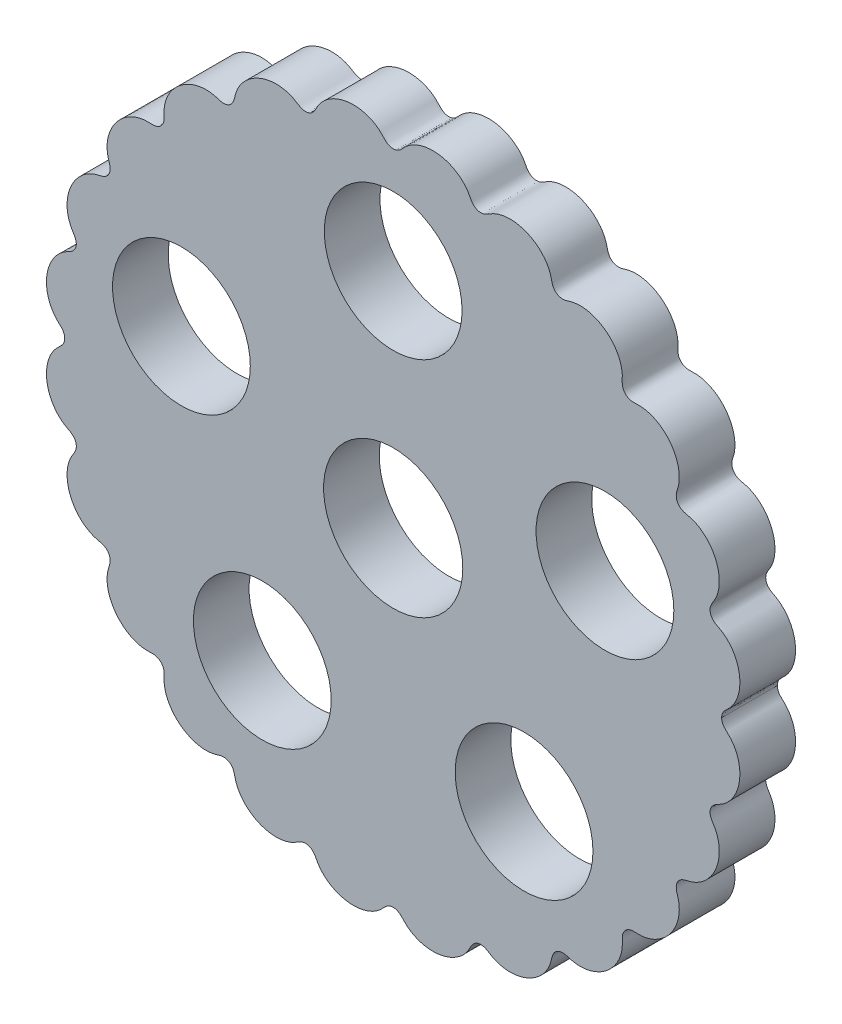
from build123d import *

# Parameters (mm, degrees)
BOSS_EXTRU_1_DEPTH      = 4
ESQUISSE2_R             = 5
ESQUISSE2_R_2           = 4.95
ENL_V_MAT_EXTRU_1_DEPTH = 36.458414662


with BuildPart() as part:
    # Esquisse1 → Boss.-Extru.1 (new body)
    with BuildSketch(Plane.XY):
        with BuildLine():
            add(Edge.make_bspline(
                [(23.6, 0), (23.6, 0.141263317), (23.694957489, 0.436529968), (23.984105148, 0.699966416), (24.214098656, 0.92210788), (24.485922993, 1.265914284), (24.738195558, 1.753151116), (24.902804155, 2.39533748), (24.929061691, 3.058471588), (24.820146126, 3.713569854), (24.57955061, 4.33187121), (24.214467979, 4.883674944), (23.809838813, 5.256722709), (23.444567676, 5.486205657), (23.121830867, 5.632182108), (22.805829464, 5.950444407), (22.734313606, 6.404992853), (22.914932417, 6.792042139), (23.100388311, 7.061569454), (23.241322807, 7.357836955), (23.379653116, 7.771179165), (23.455167998, 8.317175234), (23.400481311, 8.977844215), (23.210210839, 9.613984821), (22.894930523, 10.198352072), (22.466428325, 10.704182585), (22.026991864, 11.036841208), (21.636830993, 11.231351768), (21.327761788, 11.341047304), (21.006646284, 11.400550336), (20.604652425, 11.546398108), (20.33360552, 11.919233538), (20.332098964, 12.366005113), (20.45722004, 12.699209104), (20.553070598, 13.118610088), (20.575521706, 13.669103022), (20.443453625, 14.317226653), (20.176384255, 14.92460977), (19.790172286, 15.464839232), (19.30269971, 15.915187436), (18.732196788, 16.252890186), (18.209304306, 16.419015566), (17.773926091, 16.469947133), (17.454880581, 16.46414596), (17.062370957, 16.447336106), (16.654155245, 16.654181217), (16.447354302, 17.062303221), (16.463995345, 17.454871193), (16.47000351, 17.773792082), (16.418987054, 18.209391085), (16.252899593, 18.732164041), (15.915186599, 19.302700185), (15.464853958, 19.790162793), (14.924615452, 20.176378936), (14.317280714, 20.443456307), (13.668954873, 20.575502528), (13.119018963, 20.55312993), (12.698551766, 20.457182646), (12.366975365, 20.332173557), (11.918544843, 20.333761346), (11.546613574, 20.604610058), (11.40064872, 21.005766845), (11.341293082, 21.327714877), (11.231226117, 21.63694), (11.036938401, 22.026913374), (10.704156075, 22.466459205), (10.198341832, 22.894933668), (9.613976893, 23.210215116), (8.977833581, 23.400481614), (8.317182897, 23.455167864), (7.771097903, 23.379662569), (7.357907338, 23.241306143), (7.061498599, 23.100444819), (6.791854452, 22.914860356), (6.404942564, 22.734347878), (5.950451983, 22.805835984), (5.632237823, 23.121749776), (5.486345168, 23.444347145), (5.256676854, 23.809987802), (4.883690774, 24.214428605), (4.331849996, 24.5795686), (3.713564416, 24.820144223), (3.058466294, 24.929064174), (2.395320656, 24.902799203), (1.753142261, 24.73820842), (1.265895934, 24.485857583), (0.922135884, 24.214172246), (0.700203774, 23.984231078), (0.434473803, 23.694819976), (5.2772e-05, 23.552557421), (-0.434333113, 23.694820917), (-0.701425566, 23.984569), (-0.921337471, 24.213735069), (-1.266478689, 24.486196796), (-1.752999049, 24.738117012), (-2.395391205, 24.902832375), (-3.058454415, 24.929057732), (-3.713563151, 24.82014516), (-4.331853239, 24.579567427), (-4.883691331, 24.214428226), (-5.256677903, 23.809987443), (-5.4863451, 23.44434672), (-5.632237756, 23.12174991), (-5.950451972, 22.805835957), (-6.404942594, 22.734347884), (-6.791854452, 22.914860344), (-7.061498587, 23.100444822), (-7.357907347, 23.241306142), (-7.771097896, 23.37966257), (-8.317182899, 23.455167864), (-8.977833581, 23.400481614), (-9.613976894, 23.210215116), (-10.198341833, 22.894933668), (-10.704156075, 22.466459205), (-11.036938403, 22.026913373), (-11.231226116, 21.636940001), (-11.341293084, 21.327714875), (-11.400648718, 21.005766845), (-11.546613572, 20.60461006), (-11.918544844, 20.333761347), (-12.366975388, 20.332173538), (-12.698551664, 20.457182667), (-13.119019113, 20.553129909), (-13.668955007, 20.575502444), (-14.31728076, 20.443456275), (-14.924615464, 20.176378324), (-15.46485336, 19.790164133), (-15.915186091, 19.302700475), (-16.252900044, 18.732163975), (-16.418987453, 18.209390893), (-16.470003235, 17.773792163), (-16.463995514, 17.454871292), (-16.447354283, 17.062303151), (-16.654155252, 16.654181231), (-17.062370949, 16.447336105), (-17.454880537, 16.464145974), (-17.773926212, 16.469947179), (-18.209304238, 16.419015446), (-18.732196855, 16.252890081), (-19.302699499, 15.915187249), (-19.790172128, 15.464840391), (-20.1763834, 14.924609485), (-20.443455016, 14.317235113), (-20.575514472, 13.669078012), (-20.553095691, 13.118679577), (-20.457194791, 12.699092672), (-20.332084532, 12.366199531), (-20.33370059, 11.918980241), (-20.604412947, 11.54678832), (-21.006064592, 11.400694901), (-21.327826085, 11.341205229), (-21.636901956, 11.231235101), (-22.026915175, 11.03694368), (-22.46644734, 10.70416594), (-22.894929089, 10.198350592), (-23.210211743, 9.613983535), (-23.400479411, 8.977847773), (-23.455168277, 8.317175145), (-23.379653689, 7.771179811), (-23.241322407, 7.357836312), (-23.10038839, 7.061570012), (-22.914932508, 6.79204212), (-22.734313593, 6.404992849), (-22.805829472, 5.9504444), (-23.121830856, 5.632182119), (-23.444567687, 5.486205649), (-23.809838801, 5.256722717), (-24.214467983, 4.88367495), (-24.57955057, 4.331871224), (-24.820146163, 3.713569956), (-24.929061366, 3.058471564), (-24.90280557, 2.395337789), (-24.738191624, 1.753148162), (-24.485935157, 1.265916949), (-24.21407506, 0.922091043), (-23.984176287, 0.70007175), (-23.694816972, 0.436329885), (-23.6, 0.141221691), (-23.6, 0)],
                knots=[0.075303121, 0.075303121, 0.075303121, 0.075303121, 0.078621066, 0.081939011, 0.085256955, 0.0885749, 0.095210789, 0.101846679, 0.108482568, 0.115118457, 0.121754346, 0.128390236, 0.135026125, 0.13834407, 0.141662014, 0.144979959, 0.148297904, 0.151615848, 0.154933793, 0.158251737, 0.161569682, 0.168205571, 0.174841461, 0.18147735, 0.188113239, 0.194749129, 0.201385018, 0.204702962, 0.208020907, 0.211338852, 0.214656796, 0.217974741, 0.221292686, 0.22461063, 0.227928575, 0.234564464, 0.241200354, 0.247836243, 0.254472132, 0.261108021, 0.267743911, 0.2743798, 0.277697745, 0.281015689, 0.284333634, 0.287651579, 0.290969523, 0.294287468, 0.297605412, 0.300923357, 0.307559246, 0.314195136, 0.320831025, 0.327466914, 0.334102804, 0.340738693, 0.347374582, 0.350692527, 0.354010471, 0.357328416, 0.360646361, 0.363964305, 0.36728225, 0.370600195, 0.373918139, 0.380554029, 0.387189918, 0.393825807, 0.400461696, 0.407097586, 0.413733475, 0.41705142, 0.420369364, 0.423687309, 0.427005254, 0.430323198, 0.433641143, 0.436959087, 0.440277032, 0.446912921, 0.453548811, 0.4601847, 0.466820589, 0.473456478, 0.480092368, 0.486728257, 0.490046202, 0.493364146, 0.496682091, 0.500000036, 0.50331798, 0.506635925, 0.50995387, 0.513271814, 0.519907703, 0.526543593, 0.533179482, 0.539815371, 0.546451261, 0.55308715, 0.559723039, 0.563040984, 0.566358928, 0.569676873, 0.572994818, 0.576312762, 0.579630707, 0.582948652, 0.586266596, 0.592902486, 0.599538375, 0.606174264, 0.612810153, 0.619446043, 0.626081932, 0.629399877, 0.632717821, 0.636035766, 0.639353711, 0.642671655, 0.6459896, 0.649307545, 0.652625489, 0.659261378, 0.665897268, 0.672533157, 0.679169046, 0.685804936, 0.692440825, 0.699076714, 0.702394659, 0.705712603, 0.709030548, 0.712348493, 0.715666437, 0.718984382, 0.722302327, 0.725620271, 0.732256161, 0.73889205, 0.745527939, 0.752163828, 0.758799718, 0.765435607, 0.772071496, 0.775389441, 0.778707386, 0.78202533, 0.785343275, 0.78866122, 0.791979164, 0.795297109, 0.798615053, 0.805250943, 0.811886832, 0.818522721, 0.825158611, 0.8317945, 0.838430389, 0.841748334, 0.845066278, 0.848384223, 0.851702168, 0.855020112, 0.858338057, 0.861656002, 0.864973946, 0.871609836, 0.878245725, 0.884881614, 0.891517503, 0.898153393, 0.904789282, 0.911425171, 0.914743116, 0.918061061, 0.921379005, 0.92469695, 0.92469695, 0.92469695, 0.92469695], degree=3))
            add(Edge.make_bspline(
                [(-23.6, 0), (-23.6, -0.141221691), (-23.694816972, -0.436329885), (-23.984176287, -0.70007175), (-24.21407506, -0.922091043), (-24.485935157, -1.265916949), (-24.738191624, -1.753148162), (-24.90280557, -2.395337789), (-24.929061366, -3.058471564), (-24.820146163, -3.713569956), (-24.57955057, -4.331871224), (-24.214467983, -4.88367495), (-23.809838801, -5.256722717), (-23.444567687, -5.486205649), (-23.121830856, -5.632182119), (-22.805829472, -5.9504444), (-22.734313593, -6.404992849), (-22.914932508, -6.79204212), (-23.10038839, -7.061570012), (-23.241322407, -7.357836312), (-23.379653689, -7.771179811), (-23.455168277, -8.317175145), (-23.400479411, -8.977847773), (-23.210211743, -9.613983535), (-22.894929089, -10.198350592), (-22.46644734, -10.70416594), (-22.026915175, -11.03694368), (-21.636901956, -11.231235101), (-21.327826085, -11.341205229), (-21.006064592, -11.400694901), (-20.604412947, -11.54678832), (-20.33370059, -11.918980241), (-20.332084532, -12.366199531), (-20.457194791, -12.699092672), (-20.553095691, -13.118679577), (-20.575514472, -13.669078012), (-20.443455016, -14.317235113), (-20.1763834, -14.924609485), (-19.790172128, -15.464840391), (-19.302699499, -15.915187249), (-18.732196855, -16.252890081), (-18.209304238, -16.419015446), (-17.773926212, -16.469947179), (-17.454880537, -16.464145974), (-17.062370949, -16.447336105), (-16.654155252, -16.654181231), (-16.447354283, -17.062303151), (-16.463995514, -17.454871292), (-16.470003235, -17.773792163), (-16.418987453, -18.209390893), (-16.252900044, -18.732163975), (-15.915186091, -19.302700475), (-15.46485336, -19.790164133), (-14.924615464, -20.176378324), (-14.31728076, -20.443456275), (-13.668955007, -20.575502444), (-13.119019113, -20.553129909), (-12.698551664, -20.457182667), (-12.366975388, -20.332173538), (-11.918544844, -20.333761347), (-11.546613572, -20.60461006), (-11.400648718, -21.005766845), (-11.341293084, -21.327714875), (-11.231226116, -21.636940001), (-11.036938403, -22.026913373), (-10.704156075, -22.466459205), (-10.198341833, -22.894933668), (-9.613976894, -23.210215116), (-8.977833581, -23.400481614), (-8.317182899, -23.455167864), (-7.771097896, -23.37966257), (-7.357907347, -23.241306142), (-7.061498587, -23.100444822), (-6.791854452, -22.914860344), (-6.404942594, -22.734347884), (-5.950451972, -22.805835957), (-5.632237756, -23.12174991), (-5.4863451, -23.44434672), (-5.256677903, -23.809987443), (-4.883691331, -24.214428226), (-4.331853239, -24.579567427), (-3.713563151, -24.82014516), (-3.058454415, -24.929057732), (-2.395391205, -24.902832375), (-1.752999049, -24.738117012), (-1.266478689, -24.486196796), (-0.921337471, -24.213735069), (-0.701425566, -23.984569), (-0.434333113, -23.694820917), (5.2772e-05, -23.552557421), (0.434473803, -23.694819976), (0.700203774, -23.984231078), (0.922135884, -24.214172246), (1.265895934, -24.485857583), (1.753142261, -24.73820842), (2.395320656, -24.902799203), (3.058466294, -24.929064174), (3.713564416, -24.820144223), (4.331849996, -24.5795686), (4.883690774, -24.214428605), (5.256676854, -23.809987802), (5.486345168, -23.444347145), (5.632237823, -23.121749776), (5.950451983, -22.805835984), (6.404942564, -22.734347878), (6.791854452, -22.914860356), (7.061498599, -23.100444819), (7.357907338, -23.241306143), (7.771097903, -23.379662569), (8.317182897, -23.455167864), (8.977833581, -23.400481614), (9.613976893, -23.210215116), (10.198341832, -22.894933668), (10.704156075, -22.466459205), (11.036938401, -22.026913374), (11.231226117, -21.63694), (11.341293082, -21.327714877), (11.40064872, -21.005766845), (11.546613574, -20.604610058), (11.918544843, -20.333761346), (12.366975365, -20.332173557), (12.698551766, -20.457182646), (13.119018963, -20.55312993), (13.668954873, -20.575502528), (14.317280714, -20.443456307), (14.924615452, -20.176378936), (15.464853958, -19.790162793), (15.915186599, -19.302700185), (16.252899593, -18.732164041), (16.418987054, -18.209391085), (16.47000351, -17.773792082), (16.463995345, -17.454871193), (16.447354302, -17.062303221), (16.654155245, -16.654181217), (17.062370957, -16.447336106), (17.454880581, -16.46414596), (17.773926091, -16.469947133), (18.209304306, -16.419015566), (18.732196788, -16.252890186), (19.30269971, -15.915187436), (19.790172286, -15.464839232), (20.176384255, -14.92460977), (20.443453625, -14.317226653), (20.575521706, -13.669103022), (20.553070598, -13.118610088), (20.45722004, -12.699209104), (20.332098964, -12.366005113), (20.33360552, -11.919233538), (20.604652425, -11.546398108), (21.006646284, -11.400550336), (21.327761788, -11.341047304), (21.636830993, -11.231351768), (22.026991864, -11.036841208), (22.466428325, -10.704182585), (22.894930523, -10.198352072), (23.210210839, -9.613984821), (23.400481311, -8.977844215), (23.455167998, -8.317175234), (23.379653116, -7.771179165), (23.241322807, -7.357836955), (23.100388311, -7.061569454), (22.914932417, -6.792042139), (22.734313606, -6.404992853), (22.805829464, -5.950444407), (23.121830867, -5.632182108), (23.444567676, -5.486205657), (23.809838813, -5.256722709), (24.214467979, -4.883674944), (24.57955061, -4.33187121), (24.820146126, -3.713569854), (24.929061691, -3.058471588), (24.902804155, -2.39533748), (24.738195558, -1.753151116), (24.485922993, -1.265914284), (24.214098656, -0.92210788), (23.984105148, -0.699966416), (23.694957489, -0.436529968), (23.6, -0.141263317), (23.6, 0)],
                knots=[0.075303121, 0.075303121, 0.075303121, 0.075303121, 0.078621066, 0.081939011, 0.085256955, 0.0885749, 0.095210789, 0.101846679, 0.108482568, 0.115118457, 0.121754346, 0.128390236, 0.135026125, 0.13834407, 0.141662014, 0.144979959, 0.148297904, 0.151615848, 0.154933793, 0.158251737, 0.161569682, 0.168205571, 0.174841461, 0.18147735, 0.188113239, 0.194749129, 0.201385018, 0.204702962, 0.208020907, 0.211338852, 0.214656796, 0.217974741, 0.221292686, 0.22461063, 0.227928575, 0.234564464, 0.241200354, 0.247836243, 0.254472132, 0.261108021, 0.267743911, 0.2743798, 0.277697745, 0.281015689, 0.284333634, 0.287651579, 0.290969523, 0.294287468, 0.297605412, 0.300923357, 0.307559246, 0.314195136, 0.320831025, 0.327466914, 0.334102804, 0.340738693, 0.347374582, 0.350692527, 0.354010471, 0.357328416, 0.360646361, 0.363964305, 0.36728225, 0.370600195, 0.373918139, 0.380554029, 0.387189918, 0.393825807, 0.400461696, 0.407097586, 0.413733475, 0.41705142, 0.420369364, 0.423687309, 0.427005254, 0.430323198, 0.433641143, 0.436959087, 0.440277032, 0.446912921, 0.453548811, 0.4601847, 0.466820589, 0.473456478, 0.480092368, 0.486728257, 0.490046202, 0.493364146, 0.496682091, 0.500000036, 0.50331798, 0.506635925, 0.50995387, 0.513271814, 0.519907703, 0.526543593, 0.533179482, 0.539815371, 0.546451261, 0.55308715, 0.559723039, 0.563040984, 0.566358928, 0.569676873, 0.572994818, 0.576312762, 0.579630707, 0.582948652, 0.586266596, 0.592902486, 0.599538375, 0.606174264, 0.612810153, 0.619446043, 0.626081932, 0.629399877, 0.632717821, 0.636035766, 0.639353711, 0.642671655, 0.6459896, 0.649307545, 0.652625489, 0.659261378, 0.665897268, 0.672533157, 0.679169046, 0.685804936, 0.692440825, 0.699076714, 0.702394659, 0.705712603, 0.709030548, 0.712348493, 0.715666437, 0.718984382, 0.722302327, 0.725620271, 0.732256161, 0.73889205, 0.745527939, 0.752163828, 0.758799718, 0.765435607, 0.772071496, 0.775389441, 0.778707386, 0.78202533, 0.785343275, 0.78866122, 0.791979164, 0.795297109, 0.798615053, 0.805250943, 0.811886832, 0.818522721, 0.825158611, 0.8317945, 0.838430389, 0.841748334, 0.845066278, 0.848384223, 0.851702168, 0.855020112, 0.858338057, 0.861656002, 0.864973946, 0.871609836, 0.878245725, 0.884881614, 0.891517503, 0.898153393, 0.904789282, 0.911425171, 0.914743116, 0.918061061, 0.921379005, 0.92469695, 0.92469695, 0.92469695, 0.92469695], degree=3))
        make_face()
    extrude(amount=BOSS_EXTRU_1_DEPTH)

    # Esquisse2 → Enlèv. mat.-Extru.1 (cut, through all)
    with BuildSketch(Plane.XY.offset(4)):
        Circle(ESQUISSE2_R)
        with Locations((0, 16)):
            Circle(ESQUISSE2_R_2)
        with Locations((15.216904261, 4.94427191)):
            Circle(ESQUISSE2_R_2)
        with Locations((9.404564037, -12.94427191)):
            Circle(ESQUISSE2_R_2)
        with Locations((-9.404564037, -12.94427191)):
            Circle(ESQUISSE2_R_2)
        with Locations((-15.216904261, 4.94427191)):
            Circle(ESQUISSE2_R_2)
    extrude(amount=-ENL_V_MAT_EXTRU_1_DEPTH, mode=Mode.SUBTRACT)


solid = part.part
